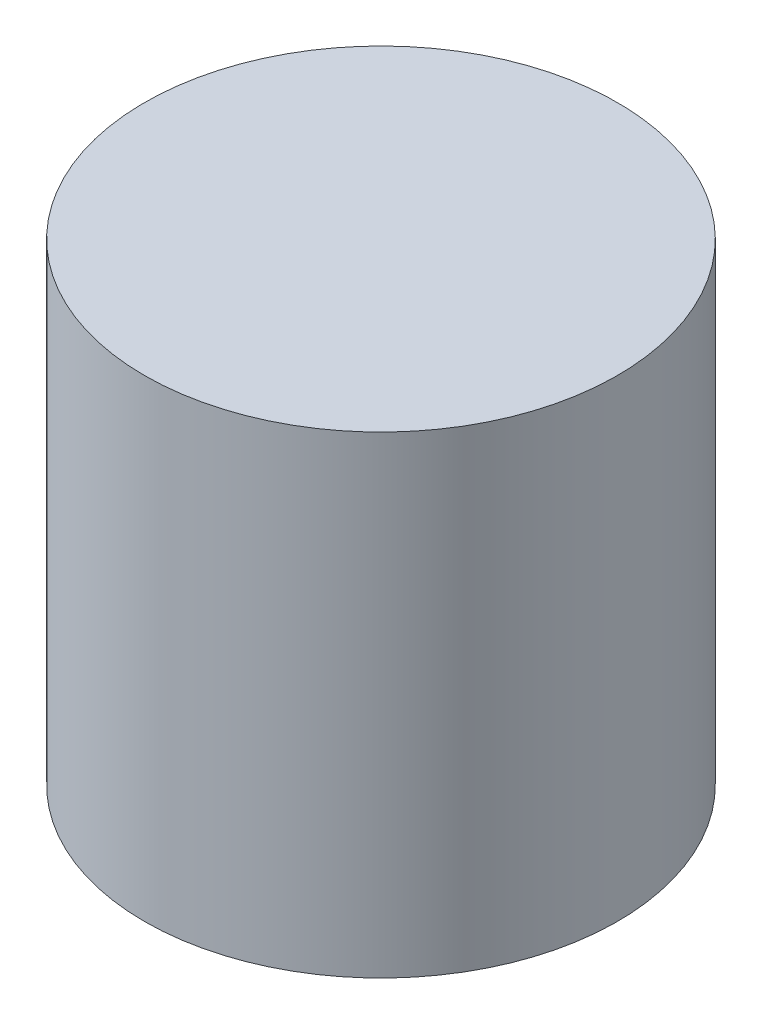
from build123d import *

# Parameters (mm, degrees)
SKETCH1_R           = 4
BOSS_EXTRUDE1_DEPTH = 8


with BuildPart() as part:
    # Sketch1 → Boss-Extrude1 (new body)
    with BuildSketch(Plane(origin=(0, 0, 0), x_dir=(1, 0, 0), z_dir=(0, 1, 0))):
        with Locations(Location((0, 0, 0), (0, 0, 270))):
            Circle(SKETCH1_R)
    extrude(amount=BOSS_EXTRUDE1_DEPTH)


solid = part.part
